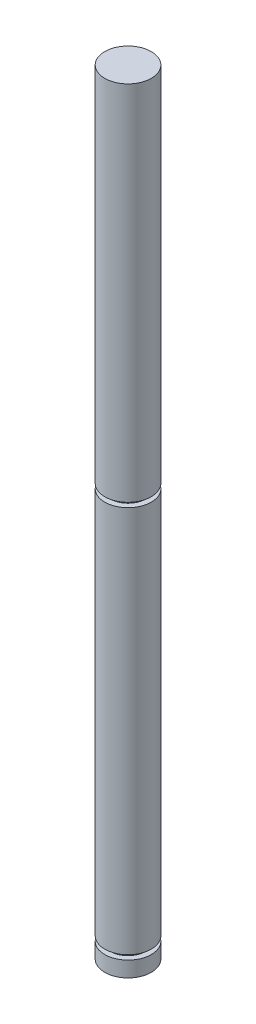
from build123d import *


with BuildPart() as part:
    # Sketch1 → Revolve2 (revolve)
    with BuildSketch(Plane.XY, mode=Mode.PRIVATE) as revolve2_sk:
        Polygon((0, 0), (0, 250), (7.5, 250), (7.5, 133), (5.75, 133), (5.75, 131.5), (7.5, 131.5), (7.5, 6.5), (5.75, 6.5), (5.75, 5), (7.5, 5), (7.5, 0), align=None)
    revolve(revolve2_sk.sketch.rotate(Axis((0, 0, 0), (0, 1, 0)), 90), axis=Axis((0, 0, 0), (0, 1, 0)))


solid = part.part
